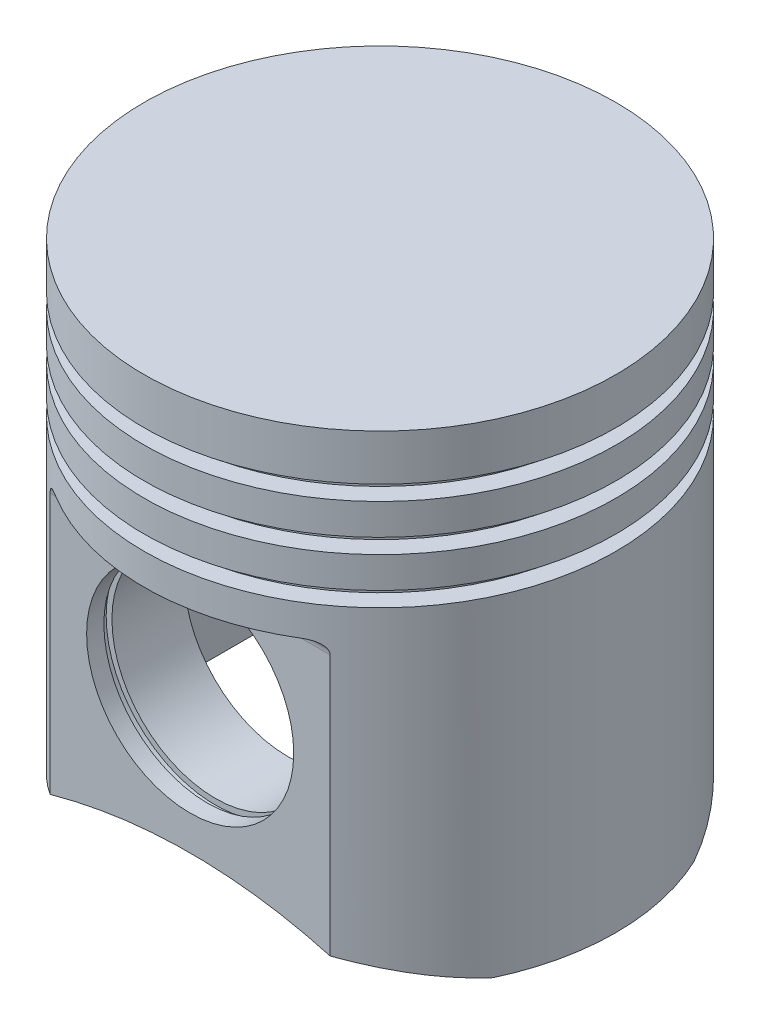
from build123d import *

# Parameters (mm, degrees)
SKETCH_13_R              = 41
EXTRUDE_3_DEPTH          = 42
CUT_EXTRUDE_1_DEPTH      = 72.596089278675
CUT_EXTRUDE_1_DEPTH_BACK = 72.596089278675
SKETCH_14_R              = 17.999999999999996
CUT_EXTRUDE_START        = -52
CUT_EXTRUDE_3_DEPTH      = 52
CUT_EXTRUDE_4_DEPTH      = 16
CUT_EXTRUDE_START_2      = -8
SKETCH_20_R              = 41
SKETCH_20_R_2            = 37.8
CUT_EXTRUDE_5_DEPTH      = 2.6
PATTERN_LINEAR_1_COUNT   = 3
PATTERN_LINEAR_1_PITCH   = 8
FILLET_1_R               = 2


with BuildPart() as part:
    # Эскиз13 → Бобышка-Вытянуть3 (new, symmetric)
    with BuildSketch(Plane(origin=(0, 0, 0), x_dir=(1, 0, 0), z_dir=(0, 1, 0))):
        with Locations(Location((0, 0, 0), (0, 0, 90))):
            Circle(SKETCH_13_R)
    extrude(amount=EXTRUDE_3_DEPTH, both=True)

    # Эскиз14 → Вырез-Вытянуть1 (cut, two sides: drawn at the far end of the back side and taken through both)
    with BuildSketch(Plane.XY.offset(-CUT_EXTRUDE_1_DEPTH_BACK)):
        with BuildLine():
            Line((-37.09447398198258, -41.99999999999993), (37.09447398198258, -41.99999999999993))
            ThreePointArc((37.09447398198258, -41.99999999999993), (5.51e-15, -34.00000000000003), (-37.09447398198258, -41.99999999999993))
        make_face()
        with Locations((0, -10.000000000000009)):
            Circle(SKETCH_14_R)
    extrude(amount=CUT_EXTRUDE_1_DEPTH + CUT_EXTRUDE_1_DEPTH_BACK, mode=Mode.SUBTRACT)

    # Эскиз16 → Вырез-Вытянуть3 (cut)
    with BuildSketch(Plane.XZ.offset(42).offset(CUT_EXTRUDE_START)):
        with BuildLine():
            ThreePointArc((24.331050121192877, 33), (2.51e-15, 41), (-24.33105012119288, 33))
            Line((-24.331050121192874, 33), (24.331050121192874, 33))
        make_face()
        with BuildLine():
            Line((24.331050121192874, -33), (-24.331050121192874, -33))
            ThreePointArc((-24.331050121192902, -32.99999999999998), (-7.53e-15, -41), (24.331050121192863, -33.000000000000014))
        make_face()
    extrude(amount=CUT_EXTRUDE_3_DEPTH, mode=Mode.SUBTRACT)

    # Эскиз18 → Вырез-Вытянуть4 (cut, symmetric)
    with BuildSketch(Plane.XY):
        with BuildLine():
            Line((-29.77638454923953, -6.3439196978451875), (-34.154400712657626, -42.00000000000001))
            Line((-34.154400712657626, -42.00000000000001), (34.15440071265802, -42.00000000000002))
            Line((34.15440071265802, -42.00000000000002), (29.7763845492392, -6.3439196978452435))
            ThreePointArc((29.7763845492392, -6.3439196978452435), (1.516e-14, 19.999999999999574), (-29.77638454923953, -6.3439196978451875))
        make_face()
    extrude(amount=CUT_EXTRUDE_4_DEPTH, both=True, mode=Mode.SUBTRACT)

    # Эскиз20 → Вырез-Вытянуть5 (cut)
    with BuildSketch(Plane(origin=(0, 42, 0), x_dir=(1, 0, 0), z_dir=(0, 1, 0)).offset(CUT_EXTRUDE_START_2)):
        with Locations(Location((0, 0, 0), (0, 0, 53.598479946))):
            Circle(SKETCH_20_R)
        with Locations(Location((0, 0, 0), (0, 0, 270))):
            Circle(SKETCH_20_R_2, mode=Mode.SUBTRACT)
    cut_extrude_5 = extrude(amount=-CUT_EXTRUDE_5_DEPTH, mode=Mode.SUBTRACT)

    # Линейный массив1: Вырез-Вытянуть5 ×3
    with Locations(*[(0, -i * PATTERN_LINEAR_1_PITCH, 0) for i in range(1, PATTERN_LINEAR_1_COUNT)]):
        add(cut_extrude_5, mode=Mode.SUBTRACT)

    # Скругление1
    fillet_1_edges = [part.edges().sort_by_distance(p)[0] for p in [
        (0, 10, 33),
        (0, 10, -33),
    ]]
    fillet(fillet_1_edges, radius=FILLET_1_R)

    # Эскиз24 → Вырез-Повернуть3 (revolve, cut)
    with BuildSketch(Plane(origin=(0, 0, 0), x_dir=(0, 0, -1), z_dir=(1, 0, 0)), mode=Mode.PRIVATE) as cut_revolve_3_sk:
        Polygon((-30.000000000000085, -29.00000000000005), (-28.600000000000087, -29.000000000000053), (-28.60000000000009, -10.000000000000053), (-30.000000000000085, -10.000000000000053), align=None)
        Polygon((28.600000000000215, -10.000000000000046), (28.600000000000218, -29.000000000000046), (30.000000000000213, -29.000000000000043), (30.00000000000021, -10.000000000000046), align=None)
    revolve(cut_revolve_3_sk.sketch.rotate(Axis((0, -10.000000000000009, -456.95829419610067), (0, 0, 1)), 90), axis=Axis((0, -10.000000000000009, -456.95829419610067), (0, 0, 1)), mode=Mode.SUBTRACT)


solid = part.part
